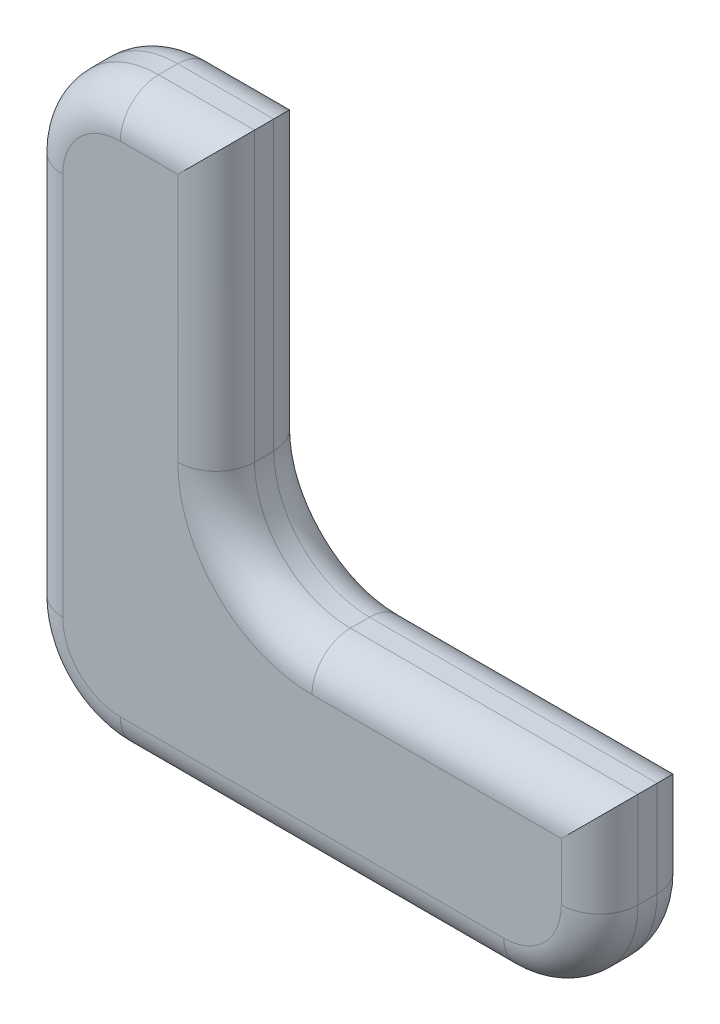
from build123d import *

# Parameters (mm, degrees)
SKETCH1_W           = 10
SKETCH1_H           = 10
BOSS_EXTRUDE1_DEPTH = 5
SKETCH2_W           = 10
SKETCH2_H           = 5
BOSS_EXTRUDE2_DEPTH = 20
SKETCH3_W           = 5
SKETCH3_H           = 10
BOSS_EXTRUDE3_DEPTH = 20
FILLET1_R           = 5
FILLET2_R           = 2


with BuildPart() as part:
    # Sketch1 → Boss-Extrude1 (new body)
    with BuildSketch(Plane.XY):
        with Locations((5, -5)):
            Rectangle(SKETCH1_W, SKETCH1_H)
    extrude(amount=BOSS_EXTRUDE1_DEPTH)

    # Sketch2 → Boss-Extrude2 (add)
    with BuildSketch(Plane(origin=(0, 0, 0), x_dir=(1, 0, 0), z_dir=(0, 1, 0))):
        with Locations((5, -2.5)):
            Rectangle(SKETCH2_W, SKETCH2_H)
    extrude(amount=BOSS_EXTRUDE2_DEPTH)

    # Sketch3 → Boss-Extrude3 (add)
    with BuildSketch(Plane(origin=(10, 0, 0), x_dir=(0, 0, -1), z_dir=(1, 0, 0))):
        with Locations((-2.5, -5)):
            Rectangle(SKETCH3_W, SKETCH3_H)
    extrude(amount=BOSS_EXTRUDE3_DEPTH)

    # Fillet1
    fillet1_edges = [part.edges().sort_by_distance(p)[0] for p in [
        (0, 20, 2.5),
        (10, 0, 2.5),
        (30, -10, 2.5),
        (0, -10, 2.5),
    ]]
    fillet(fillet1_edges, radius=FILLET1_R)

    # Fillet2
    fillet2_edges = [part.edges().sort_by_distance(p)[0] for p in [
        (7.5, 20, 0),
        (22.5, 0, 5),
        (22.5, 0, 0),
        (30, -2.5, 5),
        (30, -2.5, 0),
        (0, 5, 0),
        (10, 12.5, 0),
        (15, -10, 0),
        (1.464466094, -8.535533906, 0),
        (1.464466094, 18.535533906, 0),
        (28.535533906, -8.535533906, 0),
        (15, -10, 5),
        (0, 5, 5),
        (10, 12.5, 5),
        (7.5, 20, 5),
        (1.464466094, -8.535533906, 5),
        (1.464466094, 18.535533906, 5),
        (28.535533906, -8.535533906, 5),
        (11.464466094, 1.464466094, 5),
        (11.464466094, 1.464466094, 0),
    ]]
    fillet(fillet2_edges, radius=FILLET2_R)


solid = part.part
